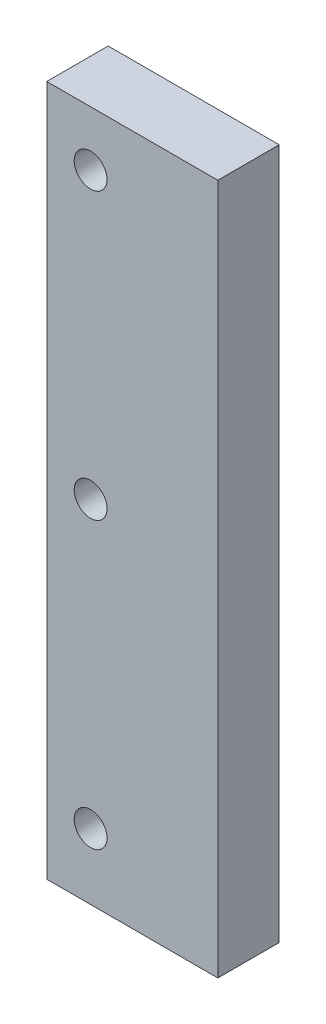
from build123d import *

# Parameters (mm, degrees)
SKETCH_1_W          = 78
SKETCH_1_H          = 315
EXTRUDE_1_DEPTH     = 28
SKETCH_2_R          = 7.5
CUT_EXTRUDE_1_DEPTH = 28


with BuildPart() as part:
    # 草图1 → 凸台-拉伸1 (new body)
    with BuildSketch(Plane.XY):
        with Locations((-7.560606061, 96.148268398)):
            Rectangle(SKETCH_1_W, SKETCH_1_H)
    extrude(amount=EXTRUDE_1_DEPTH)

    # 草图2 → 切除-拉伸1 (cut)
    with BuildSketch(Plane.XY.offset(28)):
        with Locations((-26.560606061, 228.648268398)):
            Circle(SKETCH_2_R)
        with Locations((-26.560606061, 98.648268398)):
            Circle(SKETCH_2_R)
        with Locations((-26.560606061, -31.351731602)):
            Circle(SKETCH_2_R)
    extrude(amount=-CUT_EXTRUDE_1_DEPTH, mode=Mode.SUBTRACT)


solid = part.part
